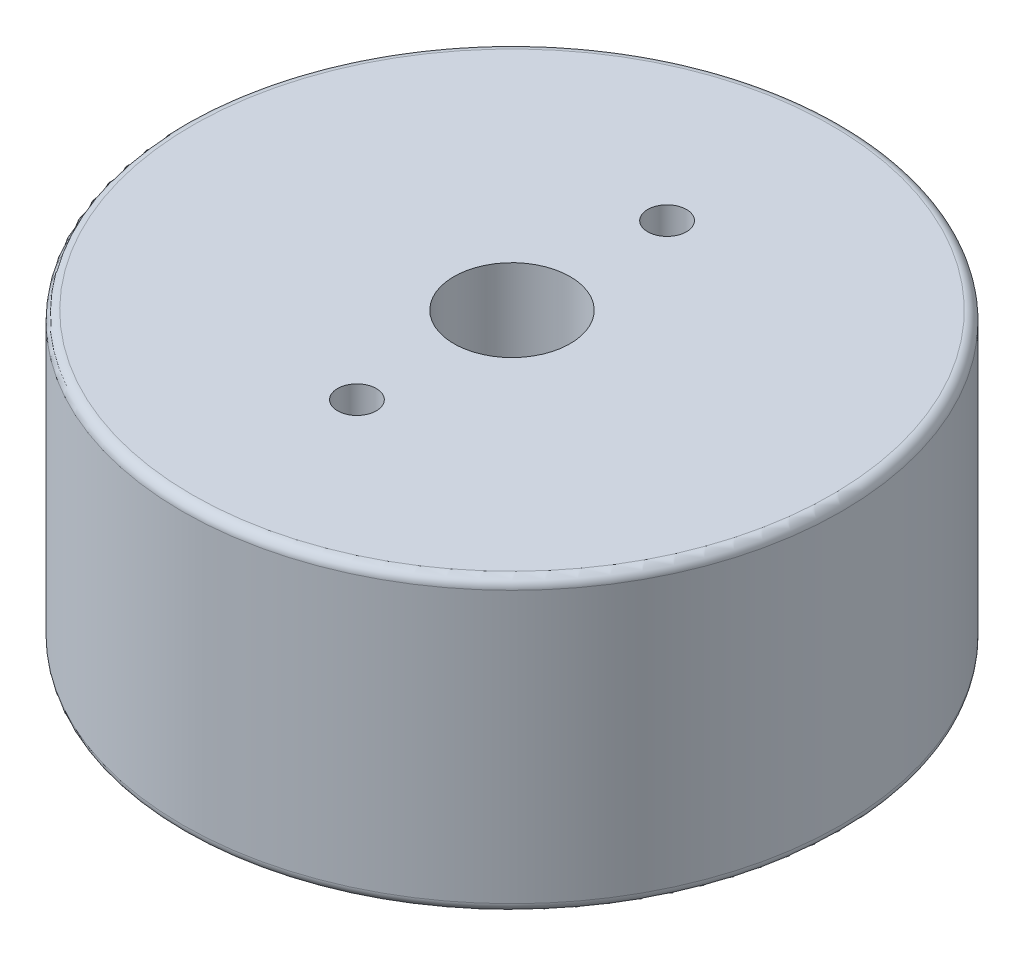
from build123d import *

# Parameters (mm, degrees)
SKETCH_1_R          = 17
EXTRUDE_1_DEPTH     = 15
SKETCH_2_R          = 1
CUT_EXTRUDE_1_DEPTH = 10
SKETCH_4_R          = 1.5
CUT_EXTRUDE_3_DEPTH = 2
CUT_EXTRUDE_4_REACH = 30.337
SKETCH_5_R          = 3
FILLET_1_R          = 0.5


with BuildPart() as part:
    # 草图1 → 凸台-拉伸1 (new body)
    with BuildSketch(Plane(origin=(0, 0, 0), x_dir=(1, 0, 0), z_dir=(0, 1, 0))):
        with Locations(Location((0, 0, 0), (0, 0, 270))):
            Circle(SKETCH_1_R)
    extrude(amount=EXTRUDE_1_DEPTH)

    # 草图2 → 切除-拉伸1 (cut)
    with BuildSketch(Plane(origin=(0, 15, 0), x_dir=(1, 0, 0), z_dir=(0, 1, 0))):
        with Locations(Location((0, 8, 0), (0, 0, 270))):
            Circle(SKETCH_2_R)
        with Locations(Location((0, -8, 0), (0, 0, 270))):
            Circle(SKETCH_2_R)
    extrude(amount=-CUT_EXTRUDE_1_DEPTH, mode=Mode.SUBTRACT)

    # 草图4 → 切除-拉伸3 (cut)
    with BuildSketch(Plane.XZ):
        with Locations(Location((0, 8, 0), (0, 0, 270))):
            Circle(SKETCH_4_R)
        with Locations(Location((8, 0, 0), (0, 0, 270))):
            Circle(SKETCH_4_R)
        with Locations(Location((0, -8, 0), (0, 0, 270))):
            Circle(SKETCH_4_R)
        with Locations(Location((-8, 0, 0), (0, 0, 270))):
            Circle(SKETCH_4_R)
    extrude(amount=-CUT_EXTRUDE_3_DEPTH, mode=Mode.SUBTRACT)

    # 草图5 → 切除-拉伸4 (cut, up to next)
    with BuildSketch(Plane.XZ, mode=Mode.PRIVATE) as cut_extrude_4_sk1:
        with Locations(Location((0, 0, 0), (0, 0, 270))):
            Circle(SKETCH_5_R)
    cut_extrude_4_tool1 = extrude(cut_extrude_4_sk1.sketch, amount=-CUT_EXTRUDE_4_REACH, mode=Mode.PRIVATE) & part.part
    add(cut_extrude_4_tool1.solids().sort_by_distance((0, 0, 0))[0], mode=Mode.SUBTRACT)

    # 圆角1
    fillet_1_edges = [part.edges().sort_by_distance(p)[0] for p in [
        (0, 0, -17),
        (0, 15, -17),
    ]]
    fillet(fillet_1_edges, radius=FILLET_1_R)


solid = part.part
